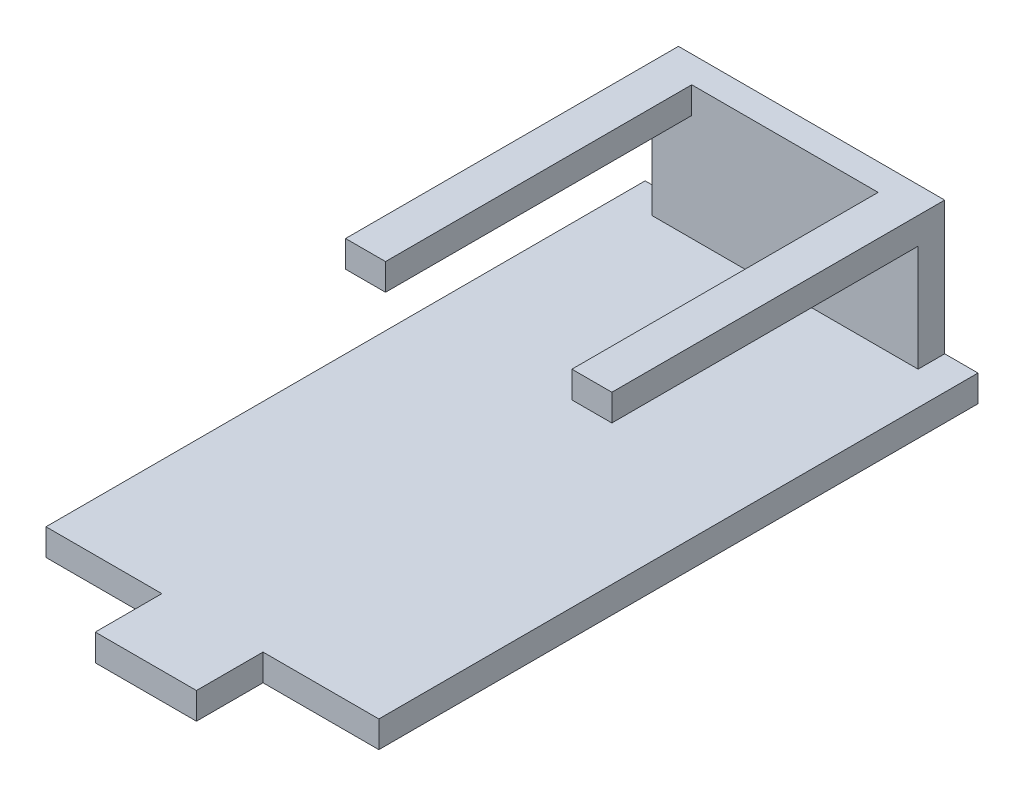
from build123d import *

# Parameters (mm, degrees)
SKETCH_1_W          = 25
SKETCH_1_H          = 50
EXTRUDE_1_DEPTH     = 2
SKETCH_3_W          = 20
SKETCH_3_H          = 2
EXTRUDE_2_DEPTH     = 10
SKETCH_4_W          = 20
SKETCH_4_H          = 2
EXTRUDE_3_DEPTH     = 23
SKETCH_5_W          = 14
SKETCH_5_H          = 23
CUT_EXTRUDE_1_DEPTH = 3
SKETCH_6_W          = 8.7
SKETCH_6_H          = 2
CUT_EXTRUDE_2_DEPTH = 5


with BuildPart() as part:
    # 草图1 → 凸台-拉伸1 (new body)
    with BuildSketch(Plane(origin=(0, 0, 0), x_dir=(1, 0, 0), z_dir=(0, 1, 0))):
        with Locations((-15.126272577, -4.709205827)):
            Rectangle(SKETCH_1_W, SKETCH_1_H)
    extrude(amount=EXTRUDE_1_DEPTH)

    # 草图3 → 凸台-拉伸2 (add)
    with BuildSketch(Plane(origin=(0, 2, 0), x_dir=(1, 0, 0), z_dir=(0, 1, 0))):
        with Locations((-15.126272577, 19.290794173)):
            Rectangle(SKETCH_3_W, SKETCH_3_H)
    extrude(amount=EXTRUDE_2_DEPTH)

    # 草图4 → 凸台-拉伸3 (add)
    with BuildSketch(Plane.XY.offset(-18.290794173)):
        with Locations((-15.126272577, 11)):
            Rectangle(SKETCH_4_W, SKETCH_4_H)
    extrude(amount=EXTRUDE_3_DEPTH)

    # 草图5 → 切除-拉伸1 (cut)
    with BuildSketch(Plane(origin=(0, 12, 0), x_dir=(1, 0, 0), z_dir=(0, 1, 0))):
        with Locations((-15.126272577, 6.790794173)):
            Rectangle(SKETCH_5_W, SKETCH_5_H)
    extrude(amount=-CUT_EXTRUDE_1_DEPTH, mode=Mode.SUBTRACT)

    # 草图6 → 切除-拉伸2 (cut)
    with BuildSketch(Plane.XY.offset(29.709205827)):
        with Locations((-6.976272577, 1)):
            Rectangle(SKETCH_6_W, SKETCH_6_H)
        with Locations((-23.276272577, 1)):
            Rectangle(SKETCH_6_W, SKETCH_6_H)
    extrude(amount=-CUT_EXTRUDE_2_DEPTH, mode=Mode.SUBTRACT)


solid = part.part
